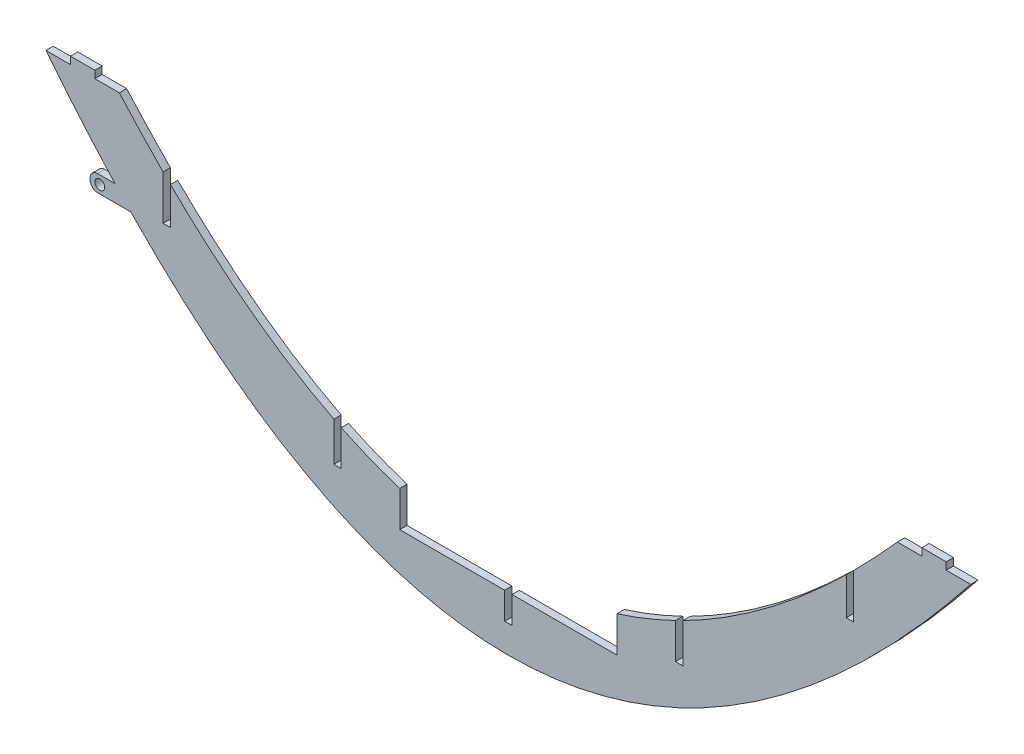
from build123d import *

# Parameters (mm, degrees)
EXTRUDE_1_DEPTH     = 3
SKETCH_2_W          = 10
SKETCH_2_H          = 3
EXTRUDE_2_DEPTH     = 3
SKETCH_3_R          = 2
EXTRUDE_3_DEPTH     = 3
SKETCH_4_W          = 89
SKETCH_4_H          = 40
CUT_EXTRUDE_1_DEPTH = 226.906067747
SKETCH_6_W          = 3
SKETCH_6_H          = 11
CUT_EXTRUDE_2_DEPTH = 226.906067747
SKETCH_7_W          = 3
SKETCH_7_H          = 16.718966486
SKETCH_7_H_2        = 18.904188623
CUT_EXTRUDE_3_DEPTH = 226.906067747


with BuildPart() as part:
    # 草图1 → 凸台-拉伸1 (new body)
    with BuildSketch(Plane.XY):
        with BuildLine():
            Line((-189.5, 119.940235), (-159.447034666, 119.940235))
            add(Edge.make_bspline(
                [(-159.447034666, 119.940235), (0, -59.940235), (159.447034666, 119.940235)],
                knots=[0.131879921, 0.131879921, 0.131879921, 0.868120079, 0.868120079, 0.868120079], degree=2))
            Line((159.447034666, 119.940235), (189.5, 119.940235))
            add(Edge.make_bspline(
                [(-189.5, 119.940235), (0, -119.940235), (189.5, 119.940235)],
                knots=[0.063497189, 0.063497189, 0.063497189, 0.936502811, 0.936502811, 0.936502811], degree=2))
        make_face()
    extrude(amount=EXTRUDE_1_DEPTH)

    # 草图2 → 凸台-拉伸2 (add)
    with BuildSketch(Plane(origin=(0, 119.940235, 0), x_dir=(1, 0, 0), z_dir=(0, 1, 0))):
        with Locations((-174.473517333, -1.5)):
            Rectangle(SKETCH_2_W, SKETCH_2_H)
        with Locations((174.473517333, -1.5)):
            Rectangle(SKETCH_2_W, SKETCH_2_H)
    extrude(amount=EXTRUDE_2_DEPTH)

    # 草图3 → 凸台-拉伸3 (add)
    with BuildSketch(Plane.XY.offset(3)):
        with BuildLine():
            Line((-154.764646507, 80), (-168.410095925, 80))
            ThreePointArc((-168.410095925, 80), (-170.531416269, 80.878679656), (-171.410095925, 83))
            Line((-171.410095925, 83), (-171.410095925, 83.819793517))
            ThreePointArc((-171.410095925, 83.819793517), (-170.531416269, 85.941113861), (-168.410095925, 86.819793517))
            Line((-168.410095925, 86.819793517), (-154.764646507, 86.819793517))
            Line((-154.764646507, 86.819793517), (-154.764646507, 80))
        make_face()
        with Locations((-167.416787516, 83.360380552)):
            Circle(SKETCH_3_R, mode=Mode.SUBTRACT)
    extrude(amount=-EXTRUDE_3_DEPTH)

    # 草图4 → 切除-拉伸1 (cut, through all)
    with BuildSketch(Plane(origin=(0, 0, 0), x_dir=(-1, 0, 0), z_dir=(0, 0, -1))):
        with Locations((0, 42.345035)):
            Rectangle(SKETCH_4_W, SKETCH_4_H)
    extrude(amount=-CUT_EXTRUDE_1_DEPTH, mode=Mode.SUBTRACT)

    # 草图6 → 切除-拉伸2 (cut, through all)
    with BuildSketch(Plane(origin=(0, 0, 0), x_dir=(-1, 0, 0), z_dir=(0, 0, -1))):
        with Locations((0, 16.845035)):
            Rectangle(SKETCH_6_W, SKETCH_6_H)
    extrude(amount=-CUT_EXTRUDE_2_DEPTH, mode=Mode.SUBTRACT)

    # 草图7 → 切除-拉伸3 (cut, through all)
    with BuildSketch(Plane(origin=(0, 0, 0), x_dir=(-1, 0, 0), z_dir=(0, 0, -1))):
        with Locations((70, 40.372399452)):
            Rectangle(SKETCH_7_W, SKETCH_7_H)
        with Locations((140, 92.037219299)):
            Rectangle(SKETCH_7_W, SKETCH_7_H_2)
        with Locations((-140, 92.037219299)):
            Rectangle(SKETCH_7_W, SKETCH_7_H_2)
        with Locations((-70, 40.372399452)):
            Rectangle(SKETCH_7_W, SKETCH_7_H)
    extrude(amount=-CUT_EXTRUDE_3_DEPTH, mode=Mode.SUBTRACT)


solid = part.part
